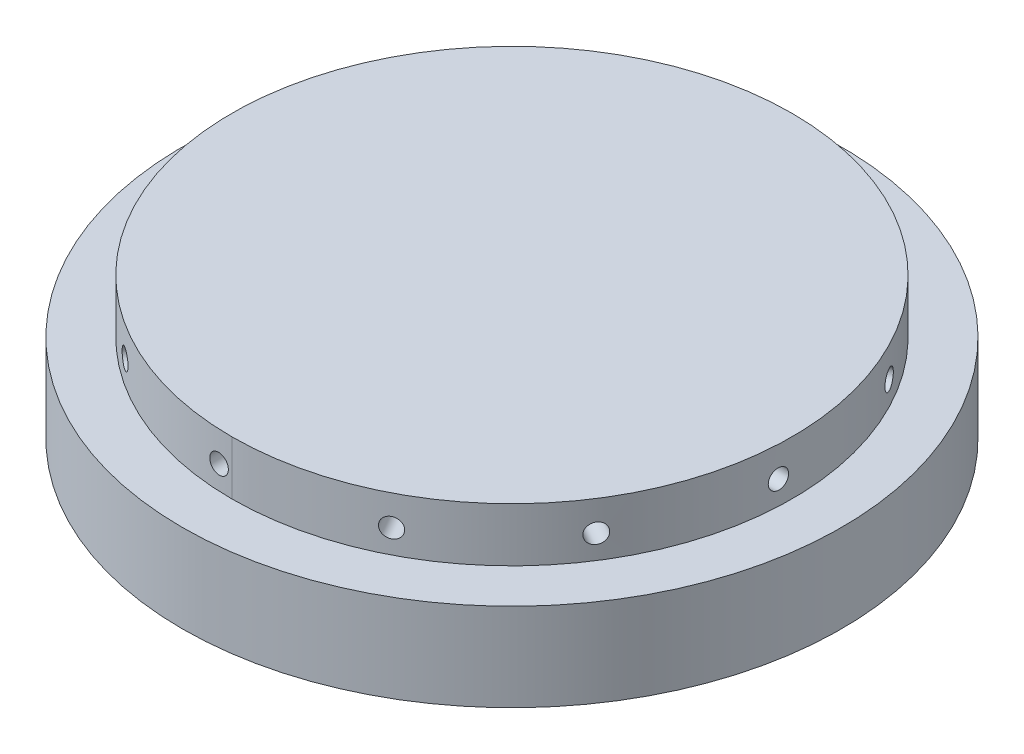
from build123d import *
from build123d.topology import SkipClean

# Parameters (mm, degrees)
SKETCH1_R                = 64.77
SKETCH1_R_2              = 56.1975
SKETCH1_R_3              = 62.865
BOSS_EXTRUDE1_DEPTH      = 17.526
BOSS_EXTRUDE2_DEPTH      = 5.08
BOSS_EXTRUDE2_DEPTH_BACK = 15.24
SKETCH1_4_R              = 76.2
SKETCH1_4_R_2            = 64.77
SKETCH1_4_R_3            = 62.865
SKETCH3_R                = 5.68325
SKETCH3_R_2              = 2.50825
SKETCH3_R_3              = 62.865
CUT_EXTRUDE1_DEPTH       = 1.8415
SKETCH3_3_R              = 1.3589
CUT_EXTRUDE2_DEPTH       = 12.7
SKETCH6_R                = 2.50825
CUT_EXTRUDE4_DEPTH       = 12.5095
CIRPATTERN2_COUNT        = 12
CUT_EXTRUDE3_REACH       = 173.287
CUT_EXTRUDE3_END_RADIUS  = 56.1975
SKETCH5_R                = 2.2479
BOSS_EXTRUDE3_START      = -5.08
BOSS_EXTRUDE3_DEPTH      = 10.16
CIRPATTERN3_COUNT        = 6
FILLET1_R                = 1.5875
CIRPATTERN4_COUNT        = 12
SKETCH3_24_R             = 1.499997
CUT_EXTRUDE7_DEPTH       = 7.9375
CIRPATTERN1_COUNT        = 3
SKETCH1_8_R              = 56.1975
BOSS_EXTRUDE4_DEPTH      = 17.526


with BuildPart() as part:
    # Sketch1 → Boss-Extrude1 (new body)
    # profile 1 of 2: a face of its own
    with BuildSketch(Plane(origin=(0, 0, 0), x_dir=(1, 0, 0), z_dir=(0, 1, 0))):
        with Locations(Location((0, 0, 0), (0, 0, 270))):
            Circle(SKETCH1_R)
        with Locations(Location((0, 0, 0), (0, 0, 270))):
            Circle(SKETCH1_R_2, mode=Mode.SUBTRACT)
    # profile 2 of 2: a face of its own
    with BuildSketch(Plane(origin=(0, 0, 0), x_dir=(1, 0, 0), z_dir=(0, 1, 0))):
        with Locations(Location((0, 0, 0), (0, 0, 270))):
            Circle(SKETCH1_R)
        Circle(SKETCH1_R_3, mode=Mode.SUBTRACT)
    extrude(amount=BOSS_EXTRUDE1_DEPTH)

    # Cut-Extrude3: up to this cylinder (the profile starts outside it)
    cut_extrude3_end = Plane(origin=(0, 10.5664, 0), z_dir=(0, -1, 0)) * Cylinder(CUT_EXTRUDE3_END_RADIUS, 459.969, mode=Mode.PRIVATE)
    # Sketch5 → Cut-Extrude3 (cut, up to the surface)
    with BuildSketch(Plane.XY.offset(76.2), mode=Mode.PRIVATE) as cut_extrude3_sk1:
        with Locations((-3.046814207, 10.5664)):
            Circle(SKETCH5_R)
    cut_extrude3_tool1 = extrude(cut_extrude3_sk1.sketch, amount=-CUT_EXTRUDE3_REACH, mode=Mode.PRIVATE) - cut_extrude3_end
    cut_extrude3 = cut_extrude3_tool1.solids().sort_by_distance((-3.046814, 10.5664, 76.2))[0]
    add(cut_extrude3, mode=Mode.SUBTRACT)



with BuildPart() as body_2:
    # Sketch1<4> → Boss-Extrude2 (new, two sides: drawn at the far end of the back side and taken through both)
    # profile 1 of 2: a face of its own
    with BuildSketch(Plane(origin=(0, 0, 0), x_dir=(1, 0, 0), z_dir=(0, 1, 0)).offset(-BOSS_EXTRUDE2_DEPTH_BACK)):
        with Locations(Location((0, 0, 0), (0, 0, 270))):
            Circle(SKETCH1_4_R)
        with Locations(Location((0, 0, 0), (0, 0, 270))):
            Circle(SKETCH1_4_R_2, mode=Mode.SUBTRACT)
    # profile 2 of 2: a face of its own
    with BuildSketch(Plane(origin=(0, 0, 0), x_dir=(1, 0, 0), z_dir=(0, 1, 0)).offset(-BOSS_EXTRUDE2_DEPTH_BACK)):
        with Locations(Location((0, 0, 0), (0, 0, 270))):
            Circle(SKETCH1_4_R_2)
        with Locations(Location((0, 0, 0), (0, 0, 270))):
            Circle(SKETCH1_4_R_3, mode=Mode.SUBTRACT)
    extrude(amount=BOSS_EXTRUDE2_DEPTH + BOSS_EXTRUDE2_DEPTH_BACK)

    # Sketch3 → Cut-Extrude1 (cut)
    # profile 1 of 10: a face of its own
    with BuildSketch(Plane.XZ.offset(15.24)):
        with Locations((-65.036704009, -11.467725653)):
            Circle(SKETCH3_R)
        with Locations((-65.036704009, -11.467725653)):
            Circle(SKETCH3_R_2, mode=Mode.SUBTRACT)
    # profile 2 of 10: a face of its own
    with BuildSketch(Plane.XZ.offset(15.24)):
        with Locations(Location((0, 0, 0), (0, 0, 90))):
            Circle(SKETCH3_R_3)
    # profile 3 of 10: a face of its own
    with BuildSketch(Plane.XZ.offset(15.24)):
        with BuildLine():
            ThreePointArc((-60.94620565, -15.413248906), (-62.367111074, -16.484956376), (-64.049818003, -17.064634315))
            Line((-64.049818003, -17.064634315), (-60.669542768, -16.468600589))
            ThreePointArc((-60.669542768, -16.468600589), (-60.810163687, -15.94152494), (-60.94620565, -15.413248906))
        make_face()
    # profile 4 of 10: a face of its own
    with BuildSketch(Plane.XZ.offset(15.24)):
        with Locations((-65.036704009, -11.467725653)):
            Circle(SKETCH3_R_2)
    # profile 5 of 10: a face of its own
    with BuildSketch(Plane.XZ.offset(15.24)):
        with BuildLine():
            ThreePointArc((-62.542341314, -6.361113732), (-62.59518473, -5.81816755), (-62.643314779, -5.274783265))
            Line((-62.643314779, -5.274783265), (-66.023590015, -5.870816991))
            ThreePointArc((-66.023590015, -5.870816991), (-64.244101198, -5.840016408), (-62.542341314, -6.361113732))
        make_face()
    # profile 6 of 10: a face of its own
    with BuildSketch(Plane.XZ.offset(15.24)):
        with Locations((-65.788697862, 5.755765251)):
            Circle(SKETCH3_R)
        with Locations((-65.788697862, 5.755765251)):
            Circle(SKETCH3_R_2, mode=Mode.SUBTRACT)
    # profile 7 of 10: a face of its own
    with BuildSketch(Plane.XZ.offset(15.24)):
        with Locations(Location((0, 0, 0), (0, 0, 90))):
            Circle(SKETCH3_R_3)
    # profile 8 of 10: a face of its own
    with BuildSketch(Plane.XZ.offset(15.24)):
        with Locations((-65.788697862, 5.755765251)):
            Circle(SKETCH3_R_2)
    # profile 9 of 10: a face of its own
    with BuildSketch(Plane.XZ.offset(15.24)):
        with BuildLine():
            ThreePointArc((-62.858756416, 0.885983564), (-64.508623965, 0.218551025), (-66.284025737, 0.094141733))
            Line((-66.284025737, 0.094141733), (-62.864665707, -0.205013506))
            ThreePointArc((-62.864665707, -0.205013506), (-62.864077868, 0.340497848), (-62.858756416, 0.885983564))
        make_face()
    # profile 10 of 10: a face of its own
    with BuildSketch(Plane.XZ.offset(15.24)):
        with BuildLine():
            ThreePointArc((-62.057640094, 10.04278502), (-61.968158101, 10.580907642), (-61.874009957, 11.11823353))
            Line((-61.874009957, 11.11823353), (-65.293369987, 11.417388769))
            ThreePointArc((-65.293369987, 11.417388769), (-63.566544004, 10.986574251), (-62.057640094, 10.04278502))
        make_face()
    cut_extrude1 = extrude(amount=-CUT_EXTRUDE1_DEPTH, mode=Mode.SUBTRACT)

    # Sketch3<3> → Cut-Extrude2 (cut)
    with BuildSketch(Plane.XZ.offset(15.24)):
        with Locations(Location((-3.046814207, 69.783518277, 0), (0, 0, 270))):
            Circle(SKETCH3_3_R)
    cut_extrude2 = extrude(amount=-CUT_EXTRUDE2_DEPTH, mode=Mode.SUBTRACT)

    # Sketch6 → Cut-Extrude4 (cut)
    with BuildSketch(Plane.XZ.offset(13.3985)):
        with Locations(Location((-65.036704009, -11.467725653, 0), (0, 0, 270))):
            Circle(SKETCH6_R)
        with Locations(Location((-65.788697862, 5.755765251, 0), (0, 0, 270))):
            Circle(SKETCH6_R)
    cut_extrude4 = extrude(amount=-CUT_EXTRUDE4_DEPTH, mode=Mode.SUBTRACT)

    # CirPattern2: Cut-Extrude2 ×12 about axis
    cirpattern2_axis = Axis((0, 0, 0), (0, 1, 0))
    for i in range(1, CIRPATTERN2_COUNT):
        add(cut_extrude2.rotate(cirpattern2_axis, i * 360 / CIRPATTERN2_COUNT), mode=Mode.SUBTRACT)


with BuildPart() as part_1:
    with SkipClean():  # the faces are left unmerged after this step: merging them gives an invalid solid
        add(part.part)

        add(body_2.part)  # Boss-Extrude3 merges body 2
        # Sketch3<11> → Boss-Extrude3 (add)
        with BuildSketch(Plane.XZ.offset(15.24).offset(BOSS_EXTRUDE3_START)):
            with BuildLine():
                Line((-13.335, -54.592460846), (-13.335, -60.116960846))
                Line((-13.335, -60.116960846), (-13.335, -61.434404042))
                ThreePointArc((-13.335, -61.434404042), (-20.075651467, -59.573286322), (-26.567897024, -56.975039032))
                Line((-26.567897024, -56.975039032), (-23.750089764, -50.932231862))
                ThreePointArc((-23.750089764, -50.932231862), (-18.63264044, -53.018711004), (-13.335, -54.592460846))
            make_face()
        boss_extrude3 = extrude(amount=-BOSS_EXTRUDE3_DEPTH)

    # CirPattern3: Boss-Extrude3 ×6 about axis
    cirpattern3_axis = Axis((0, 0, 0), (0, 1, 0))
    for i in range(1, CIRPATTERN3_COUNT):
        add(boss_extrude3.rotate(cirpattern3_axis, i * 360 / CIRPATTERN3_COUNT))

    # Fillet1
    fillet1_edges = [part_1.edges().sort_by_distance(p)[0] for p in [
        (-13.335, -5.08, -61.434404042),
        (-26.567897024, -5.08, -56.975039032),
        (-59.871254567, -5.08, -19.168753262),
        (-62.625779696, -5.08, -5.479045768),
        (-46.536254567, -5.08, 42.26565078),
        (-36.057882671, -5.08, 51.495993264),
        (13.335, -5.08, 61.434404042),
        (26.567897024, -5.08, 56.975039032),
        (59.871254567, -5.08, 19.168753262),
        (62.625779696, -5.08, 5.479045768),
        (46.536254567, -5.08, -42.26565078),
        (36.057882671, -5.08, -51.495993264),
    ]]
    fillet(fillet1_edges, radius=FILLET1_R)

    # CirPattern4: Cut-Extrude3 ×12 about axis
    with SkipClean():  # the faces are left unmerged after this step: merging them gives an invalid solid
        cirpattern4_axis = Axis((0, 0, 0), (0, -1, 0))
        for i in range(1, CIRPATTERN4_COUNT):
            add(cut_extrude3.rotate(cirpattern4_axis, i * 360 / CIRPATTERN4_COUNT), mode=Mode.SUBTRACT)

    # Sketch3<24> → Cut-Extrude7 (cut)
    with SkipClean():  # the faces are left unmerged after this step: merging them gives an invalid solid
        with BuildSketch(Plane.XZ.offset(15.24)):
            with Locations(Location((-21.004300095, 66.61712901, 0), (0, 0, 270))):
                Circle(SKETCH3_24_R)
        cut_extrude7 = extrude(amount=-CUT_EXTRUDE7_DEPTH, mode=Mode.SUBTRACT)

    # CirPattern1: Cut-Extrude1, Cut-Extrude4, Cut-Extrude7 ×3 about axis
    with SkipClean():  # the faces are left unmerged after this step: merging them gives an invalid solid
        cirpattern1_axis = Axis((0, 0, 0), (0, 1, 0))
        add([cut_extrude1.rotate(cirpattern1_axis, i * 360 / CIRPATTERN1_COUNT) for i in range(1, CIRPATTERN1_COUNT)], mode=Mode.SUBTRACT)
        add([cut_extrude4.rotate(cirpattern1_axis, i * 360 / CIRPATTERN1_COUNT) for i in range(1, CIRPATTERN1_COUNT)], mode=Mode.SUBTRACT)
        add([cut_extrude7.rotate(cirpattern1_axis, i * 360 / CIRPATTERN1_COUNT) for i in range(1, CIRPATTERN1_COUNT)], mode=Mode.SUBTRACT)

    # Sketch1<8> → Boss-Extrude4 (add)
    with BuildSketch(Plane(origin=(0, 0, 0), x_dir=(1, 0, 0), z_dir=(0, 1, 0))):
        Circle(SKETCH1_8_R)
    extrude(amount=BOSS_EXTRUDE4_DEPTH)


solid = part_1.part
